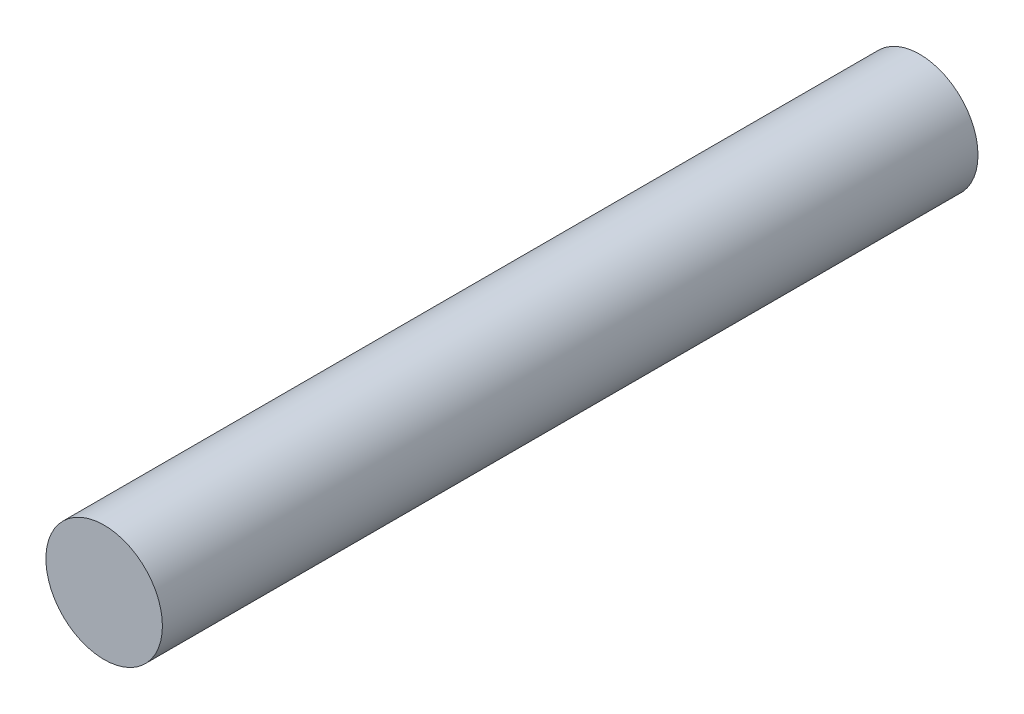
from build123d import *

# Parameters (mm, degrees)
SKETCH1_R           = 3.175
BOSS_EXTRUDE1_DEPTH = 44.45


with BuildPart() as part:
    # Sketch1 → Boss-Extrude1 (new body)
    with BuildSketch(Plane.XY):
        Circle(SKETCH1_R)
    extrude(amount=BOSS_EXTRUDE1_DEPTH)


solid = part.part
